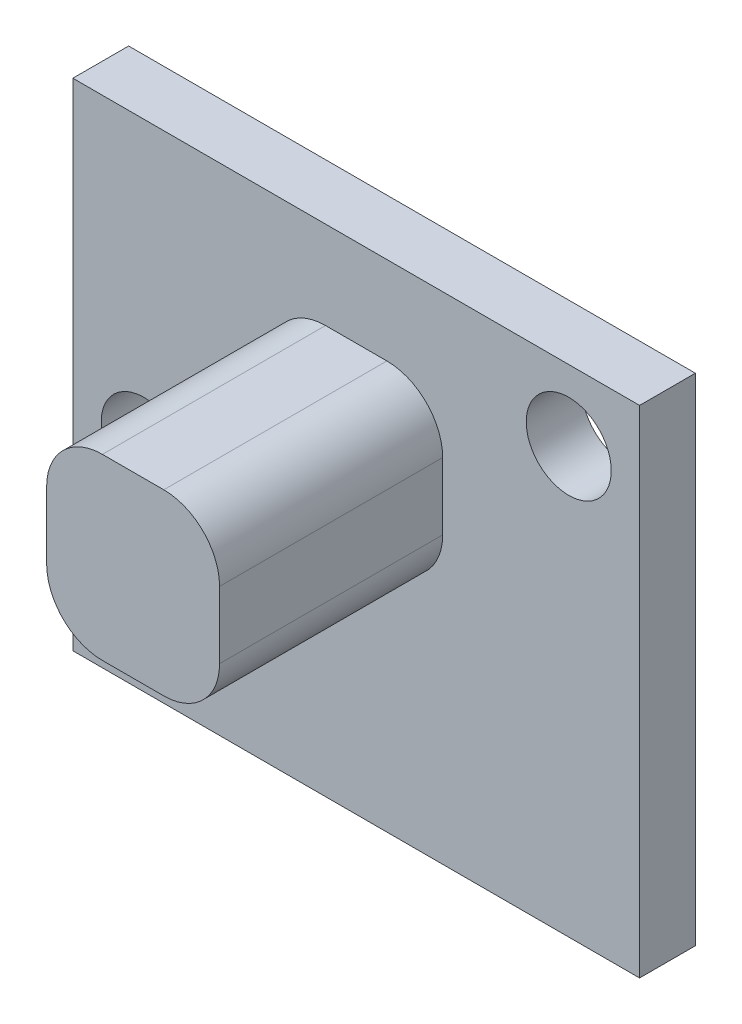
from build123d import *

# Parameters (mm, degrees)
MODEL_W             = 20.32
MODEL_H             = 17.78
MODEL_R             = 1.524
MODEL_W_2           = 6.1999876
MODEL_H_2           = 6.3999872
BOSS_EXTRUDE1_DEPTH = 2
MODEL_3_W           = 6.1999876
MODEL_3_H           = 6.3999872
BOSS_EXTRUDE2_DEPTH = 10
FILLET1_R           = 2


with BuildPart() as part:
    # Model → Boss-Extrude1 (new body)
    with BuildSketch(Plane.XY):
        with Locations((10.16, 8.89)):
            Rectangle(MODEL_W, MODEL_H)
        with Locations((2.54, 7.62)):
            Circle(MODEL_R, mode=Mode.SUBTRACT)
        with Locations((17.78, 15.24)):
            Circle(MODEL_R, mode=Mode.SUBTRACT)
        with Locations((10.16, 11.43)):
            Rectangle(MODEL_W_2, MODEL_H_2, mode=Mode.SUBTRACT)
    extrude(amount=BOSS_EXTRUDE1_DEPTH)

    # Model<3> → Boss-Extrude2 (add)
    with BuildSketch(Plane.XY):
        with Locations((10.16, 11.43)):
            Rectangle(MODEL_3_W, MODEL_3_H)
    extrude(amount=BOSS_EXTRUDE2_DEPTH)

    # Fillet1
    fillet1_edges = [part.edges().sort_by_distance(p)[0] for p in [
        (7.0600062, 14.6299936, 6),
        (7.0600062, 8.2300064, 6),
        (13.2599938, 8.2300064, 6),
        (13.2599938, 14.6299936, 6),
    ]]
    fillet(fillet1_edges, radius=FILLET1_R)


solid = part.part
